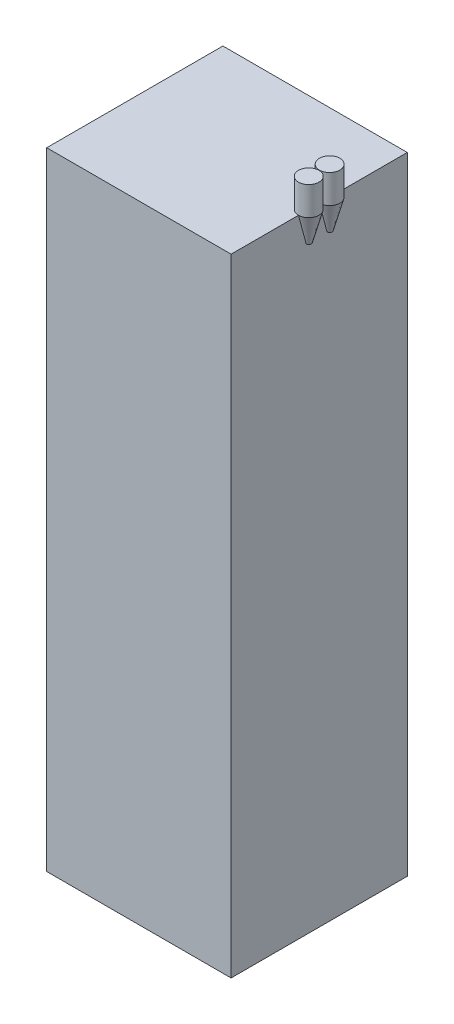
from build123d import *

# Parameters (mm, degrees)
SKETCH1_W                     = 45
SKETCH1_H                     = 43
BOSS_EXTRUDE1_DEPTH           = 153
SKETCH2_R                     = 2.5
BOSS_EXTRUDE4_DEPTH           = 7
SKETCH3_R                     = 2.5
BOSS_EXTRUDE5_DEPTH           = 7
BOSS_EXTRUDE5_DRAFT           = 15
BOSS_EXTRUDE5_PROFILE_2_DEPTH = 7
BOSS_EXTRUDE5_PROFILE_2_DRAFT = 15


with BuildPart() as part:
    # Sketch1 → Boss-Extrude1 (new body)
    with BuildSketch(Plane(origin=(0, 0, 0), x_dir=(1, 0, 0), z_dir=(0, 1, 0))):
        Rectangle(SKETCH1_W, SKETCH1_H)
    extrude(amount=BOSS_EXTRUDE1_DEPTH)

    # Sketch2 → Boss-Extrude4 (add)
    with BuildSketch(Plane(origin=(0, 153, 0), x_dir=(1, 0, 0), z_dir=(0, 1, 0))):
        with Locations(Location((22.5, -2.55, 0), (0, 0, 270))):
            Circle(SKETCH2_R)
        with Locations(Location((22.5, 2.55, 0), (0, 0, 270))):
            Circle(SKETCH2_R)
    extrude(amount=BOSS_EXTRUDE4_DEPTH)


with BuildPart() as boss_extrude5_tool:
    # Sketch3 → Boss-Extrude5 (with draft: the straight prism first)
    with BuildSketch(Plane.XZ.offset(-153)):
        with Locations(Location((22.5, 2.55, 0), (0, 0, 90))):
            Circle(SKETCH3_R)
    extrude(amount=BOSS_EXTRUDE5_DEPTH)
    # Boss-Extrude5: the draft: its side faces are tilted about the plane it starts from
    boss_extrude5_sides = [boss_extrude5_tool.faces().sort_by_distance(p)[0] for p in [
        (22.5, 149.5, 0.05),
    ]]
    draft(boss_extrude5_sides, Plane.XZ.offset(-153), BOSS_EXTRUDE5_DRAFT)


with BuildPart() as part_1:
    add(part.part)

    # Boss-Extrude5: add boss_extrude5_tool
    add(boss_extrude5_tool.part)


with BuildPart() as boss_extrude5_profile_2_tool:
    # Sketch3 → Boss-Extrude5 profile 2 (with draft: the straight prism first)
    with BuildSketch(Plane.XZ.offset(-153)):
        with Locations(Location((22.5, -2.55, 0), (0, 0, 90))):
            Circle(SKETCH3_R)
    extrude(amount=BOSS_EXTRUDE5_PROFILE_2_DEPTH)
    # Boss-Extrude5 profile 2: the draft: its side faces are tilted about the plane it starts from
    boss_extrude5_profile_2_sides = [boss_extrude5_profile_2_tool.faces().sort_by_distance(p)[0] for p in [
        (22.5, 149.5, -5.05),
    ]]
    draft(boss_extrude5_profile_2_sides, Plane.XZ.offset(-153), BOSS_EXTRUDE5_PROFILE_2_DRAFT)


with BuildPart() as part_2:
    add(part_1.part)

    # Boss-Extrude5 profile 2: add boss_extrude5_profile_2_tool
    add(boss_extrude5_profile_2_tool.part)


solid = part_2.part
